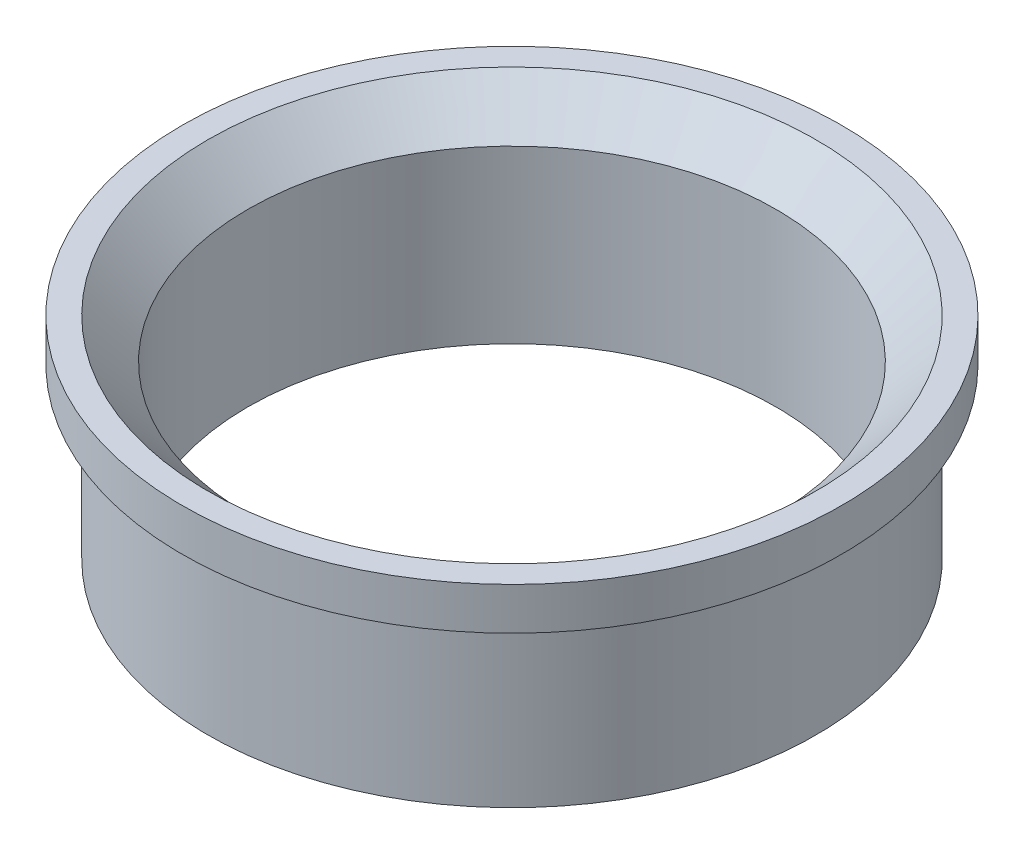
from build123d import *


with BuildPart() as part:
    # Sketch1 → Revolve1 (revolve)
    with BuildSketch(Plane.XY, mode=Mode.PRIVATE) as revolve1_sk:
        Polygon((72, 0), (72, 40), (78, 40), (78, 50), (72, 50), (62.5, 40.5), (62.5, 0), align=None)
    revolve(revolve1_sk.sketch.rotate(Axis((0, 0, 0), (0, -1, 0)), 180), axis=Axis((0, 0, 0), (0, -1, 0)))


solid = part.part
